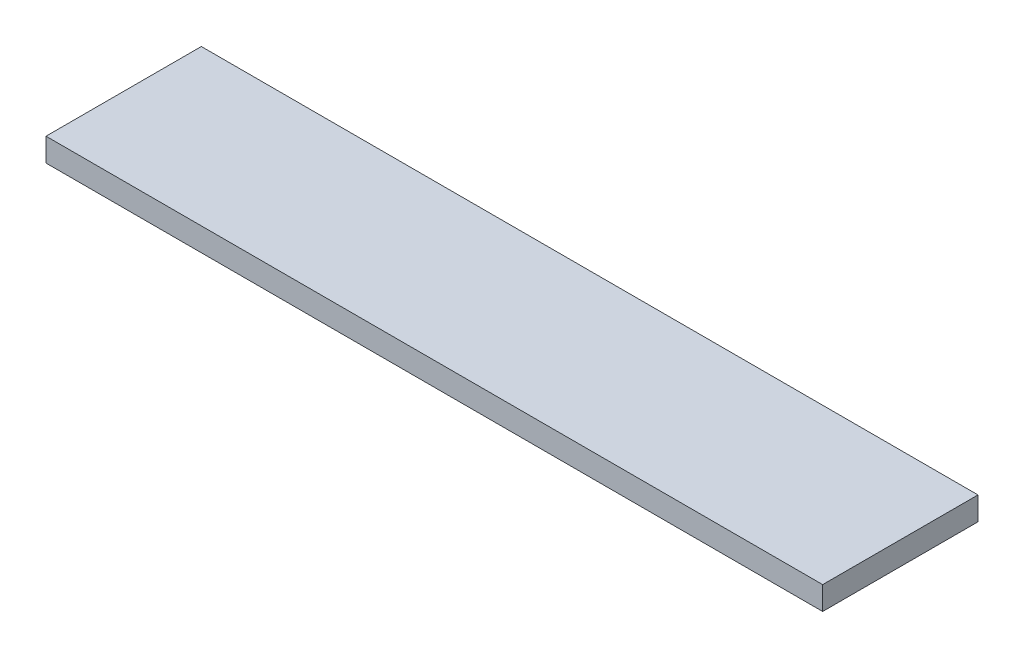
from build123d import *

# Parameters (mm, degrees)
ESBO_O2_W                = 100
ESBO_O2_H                = 20
RESSALTO_EXTRUS_O2_DEPTH = 3


with BuildPart() as part:
    # Esboço2 → Ressalto-extrusão2 (new body)
    with BuildSketch(Plane(origin=(0, 0, 0), x_dir=(1, 0, 0), z_dir=(0, 1, 0))):
        with Locations((5.080594925, 0.179563263)):
            Rectangle(ESBO_O2_W, ESBO_O2_H)
    extrude(amount=RESSALTO_EXTRUS_O2_DEPTH)


solid = part.part
